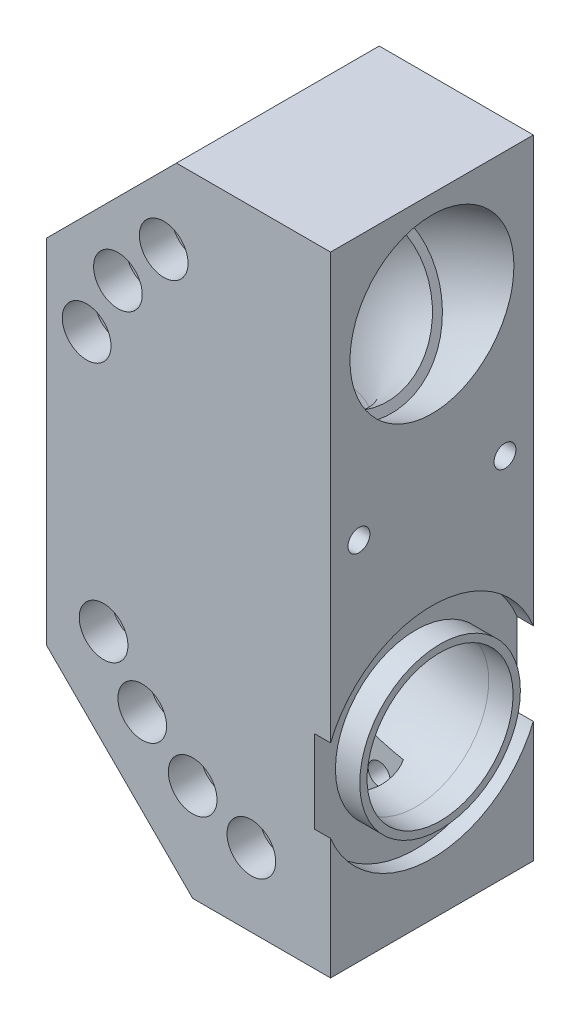
from build123d import *

# Parameters (mm, degrees)
SKETCH_1_R          = 1.35
EXTRUDE_1_DEPTH     = 12.5
SKETCH_3_R          = 9
SKETCH_4_R          = 9.9
SKETCH_4_R_2        = 9
EXTRUDE_2_DEPTH     = 1
CUT_EXTRUDE_START   = -2
SKETCH_5_R          = 13.5
SKETCH_5_R_2        = 9.9
CUT_EXTRUDE_1_DEPTH = 2
SKETCH_6_R          = 10.1
CUT_EXTRUDE_2_DEPTH = 3.25
SKETCH_10_R         = 1.35
CUT_EXTRUDE_3_DEPTH = 8
CUT_EXTRUDE_4_REACH = 60.397
SKETCH_11_R         = 1.6
SKETCH_12_R         = 3
CUT_EXTRUDE_5_DEPTH = 4


with BuildPart() as part:
    # 草图1 → 凸台-拉伸1 (new, symmetric)
    with BuildSketch(Plane.XY):
        Polygon((0, 0), (0, 39.5), (-19, 39.5), (-35, 23.5), (-35, -20), (-17, -38), (0, -38), align=None)
        with Locations((-27.980762114, -15)):
            Circle(SKETCH_1_R, mode=Mode.SUBTRACT)
        with Locations((-23.213203436, -21.213203436)):
            Circle(SKETCH_1_R, mode=Mode.SUBTRACT)
        with Locations((-17, -25.980762114)):
            Circle(SKETCH_1_R, mode=Mode.SUBTRACT)
        with Locations((-9.764571353, -28.977774789)):
            Circle(SKETCH_1_R, mode=Mode.SUBTRACT)
        with Locations((-30.070163865, 15.944644586)):
            Circle(SKETCH_1_R, mode=Mode.SUBTRACT)
        with Locations((-26.212865417, 23.354445963)):
            Circle(SKETCH_1_R, mode=Mode.SUBTRACT)
        with Locations((-20.56920351, 29.51342218)):
            Circle(SKETCH_1_R, mode=Mode.SUBTRACT)
    extrude(amount=EXTRUDE_1_DEPTH, both=True)

    # 切除-扫描1: sweep along a path in 草图2
    with BuildLine(Plane.XY) as sweep_1_path:
        Line((0, -18), (-2, -18))
        ThreePointArc((-2, -18), (-14.727922061, -12.727922061), (-20, 0))
        Line((-20, 0), (-20, 5))
        ThreePointArc((-20, 5), (-17.320508076, 15), (-10, 22.320508076))
        ThreePointArc((-10, 22.320508076), (3.381115126, 27.650519119), (17.726426944, 28.94484851))
    # 草图3 → 切除-扫描1 (sweep, cut)
    with BuildSketch(Plane(origin=(0, 0, 0), x_dir=(0, 0, -1), z_dir=(1, 0, 0))):
        with Locations((0, -18)):
            Circle(SKETCH_3_R)
    sweep(path=sweep_1_path.line, mode=Mode.SUBTRACT)

    # 草图4 → 凸台-拉伸2 (add)
    with BuildSketch(Plane(origin=(0, 0, 0), x_dir=(0, 0, -1), z_dir=(1, 0, 0))):
        with Locations(Location((0, -18, 0), (0, 0, 180))):
            Circle(SKETCH_4_R)
        with Locations((0, -18)):
            Circle(SKETCH_4_R_2, mode=Mode.SUBTRACT)
    extrude(amount=EXTRUDE_2_DEPTH)

    # 草图5 → 切除-拉伸1 (cut)
    with BuildSketch(Plane(origin=(0, 0, 0), x_dir=(0, 0, -1), z_dir=(1, 0, 0)).offset(CUT_EXTRUDE_START)):
        with Locations((0, -18)):
            Circle(SKETCH_5_R)
        with Locations((0, -18)):
            Circle(SKETCH_5_R_2, mode=Mode.SUBTRACT)
    extrude(amount=CUT_EXTRUDE_1_DEPTH, mode=Mode.SUBTRACT)

    # 切除-扫描4: sweep along a path in 草图7
    with BuildLine(Plane.XY) as sweep_4_path:
        ThreePointArc((17.726426944, 28.94484851), (3.381115126, 27.650519119), (-10, 22.320508076))
    # 草图6 → 切除-扫描4 (sweep, cut)
    with BuildSketch(Plane(origin=(2.165063509, 1.25, 0), x_dir=(0, 0, -1), z_dir=(0.8660254037844397, 0.4999999999999983, 0))):
        with Locations((0, 24.330127019)):
            Circle(SKETCH_6_R)
    sweep(path=sweep_4_path.line, mode=Mode.SUBTRACT)

    # 草图9 → 切除-拉伸2 (cut, symmetric)
    with BuildSketch(Plane.XY):
        with BuildLine():
            ThreePointArc((-22.812131801, 25.903467515), (-17.697945128, 32.646850861), (-23.969937126, 26.964400628))
            ThreePointArc((-23.969937126, 26.964400628), (-29.694261605, 25.792145818), (-28.837986521, 20.012105587))
            ThreePointArc((-28.837986521, 20.012105587), (-32.032595471, 12.174848545), (-27.445042761, 19.286984962))
            ThreePointArc((-27.445042761, 19.286984962), (-22.731469229, 20.916746109), (-22.812131801, 25.903467515))
        make_face()
        with BuildLine():
            ThreePointArc((-24.286358775, -17.100924552), (-30.567998187, -11.628248304), (-26.907606774, -19.112278884))
            ThreePointArc((-26.907606774, -19.112278884), (-26.218407256, -24.218407256), (-21.112278884, -24.907606774))
            ThreePointArc((-21.112278884, -24.907606774), (-19.125, -29.66137008), (-14.014480772, -29.005522425))
            ThreePointArc((-14.014480772, -29.005522425), (-5.83808334, -30.604179376), (-12.750090581, -25.953014478))
            ThreePointArc((-12.750090581, -25.953014478), (-14.875, -22.300154147), (-19.100924552, -22.286358775))
            ThreePointArc((-19.100924552, -22.286358775), (-20.207999616, -18.207999616), (-24.286358775, -17.100924552))
        make_face()
    extrude(amount=CUT_EXTRUDE_2_DEPTH, both=True, mode=Mode.SUBTRACT)

    # 草图10 → 切除-拉伸3 (cut)
    with BuildSketch(Plane(origin=(0, 0, 0), x_dir=(0, 0, -1), z_dir=(1, 0, 0))):
        with Locations((-9, 7)):
            Circle(SKETCH_10_R)
        with Locations((9, 7)):
            Circle(SKETCH_10_R)
    extrude(amount=-CUT_EXTRUDE_3_DEPTH, mode=Mode.SUBTRACT)

    # 草图11 → 切除-拉伸4 (cut, up to next)
    with BuildSketch(Plane.XY.offset(12.5), mode=Mode.PRIVATE) as cut_extrude_4_sk1:
        with Locations((-20.56920351, 29.51342218)):
            Circle(SKETCH_11_R)
    cut_extrude_4_tool1 = extrude(cut_extrude_4_sk1.sketch, amount=-CUT_EXTRUDE_4_REACH, mode=Mode.PRIVATE) & part.part
    # 草图11 → 切除-拉伸4 (cut, up to next)
    with BuildSketch(Plane.XY.offset(12.5), mode=Mode.PRIVATE) as cut_extrude_4_sk2:
        with Locations((-26.212865417, 23.354445963)):
            Circle(SKETCH_11_R)
    cut_extrude_4_tool2 = extrude(cut_extrude_4_sk2.sketch, amount=-CUT_EXTRUDE_4_REACH, mode=Mode.PRIVATE) & part.part
    # 草图11 → 切除-拉伸4 (cut, up to next)
    with BuildSketch(Plane.XY.offset(12.5), mode=Mode.PRIVATE) as cut_extrude_4_sk3:
        with Locations((-30.070163865, 15.944644586)):
            Circle(SKETCH_11_R)
    cut_extrude_4_tool3 = extrude(cut_extrude_4_sk3.sketch, amount=-CUT_EXTRUDE_4_REACH, mode=Mode.PRIVATE) & part.part
    # 草图11 → 切除-拉伸4 (cut, up to next)
    with BuildSketch(Plane.XY.offset(12.5), mode=Mode.PRIVATE) as cut_extrude_4_sk4:
        with Locations((-27.980762114, -15)):
            Circle(SKETCH_11_R)
    cut_extrude_4_tool4 = extrude(cut_extrude_4_sk4.sketch, amount=-CUT_EXTRUDE_4_REACH, mode=Mode.PRIVATE) & part.part
    # 草图11 → 切除-拉伸4 (cut, up to next)
    with BuildSketch(Plane.XY.offset(12.5), mode=Mode.PRIVATE) as cut_extrude_4_sk5:
        with Locations((-23.213203436, -21.213203436)):
            Circle(SKETCH_11_R)
    cut_extrude_4_tool5 = extrude(cut_extrude_4_sk5.sketch, amount=-CUT_EXTRUDE_4_REACH, mode=Mode.PRIVATE) & part.part
    # 草图11 → 切除-拉伸4 (cut, up to next)
    with BuildSketch(Plane.XY.offset(12.5), mode=Mode.PRIVATE) as cut_extrude_4_sk6:
        with Locations((-17, -25.980762114)):
            Circle(SKETCH_11_R)
    cut_extrude_4_tool6 = extrude(cut_extrude_4_sk6.sketch, amount=-CUT_EXTRUDE_4_REACH, mode=Mode.PRIVATE) & part.part
    # 草图11 → 切除-拉伸4 (cut, up to next)
    with BuildSketch(Plane.XY.offset(12.5), mode=Mode.PRIVATE) as cut_extrude_4_sk7:
        with Locations((-9.764571353, -28.977774789)):
            Circle(SKETCH_11_R)
    cut_extrude_4_tool7 = extrude(cut_extrude_4_sk7.sketch, amount=-CUT_EXTRUDE_4_REACH, mode=Mode.PRIVATE) & part.part
    add(cut_extrude_4_tool1.solids().sort_by_distance((-20.569204, 29.513422, 12.5))[0], mode=Mode.SUBTRACT)
    add(cut_extrude_4_tool2.solids().sort_by_distance((-26.212865, 23.354446, 12.5))[0], mode=Mode.SUBTRACT)
    add(cut_extrude_4_tool3.solids().sort_by_distance((-30.070164, 15.944645, 12.5))[0], mode=Mode.SUBTRACT)
    add(cut_extrude_4_tool4.solids().sort_by_distance((-27.980762, -15, 12.5))[0], mode=Mode.SUBTRACT)
    add(cut_extrude_4_tool5.solids().sort_by_distance((-23.213203, -21.213203, 12.5))[0], mode=Mode.SUBTRACT)
    add(cut_extrude_4_tool6.solids().sort_by_distance((-17, -25.980762, 12.5))[0], mode=Mode.SUBTRACT)
    add(cut_extrude_4_tool7.solids().sort_by_distance((-9.764571, -28.977775, 12.5))[0], mode=Mode.SUBTRACT)

    # 草图12 → 切除-拉伸5 (cut)
    with BuildSketch(Plane.XY.offset(12.5)):
        with Locations((-20.56920351, 29.51342218)):
            Circle(SKETCH_12_R)
        with Locations((-26.212865417, 23.354445963)):
            Circle(SKETCH_12_R)
        with Locations((-30.070163865, 15.944644586)):
            Circle(SKETCH_12_R)
        with Locations((-27.980762114, -15)):
            Circle(SKETCH_12_R)
        with Locations((-23.213203436, -21.213203436)):
            Circle(SKETCH_12_R)
        with Locations((-17, -25.980762114)):
            Circle(SKETCH_12_R)
        with Locations((-9.764571353, -28.977774789)):
            Circle(SKETCH_12_R)
    extrude(amount=-CUT_EXTRUDE_5_DEPTH, mode=Mode.SUBTRACT)


solid = part.part
